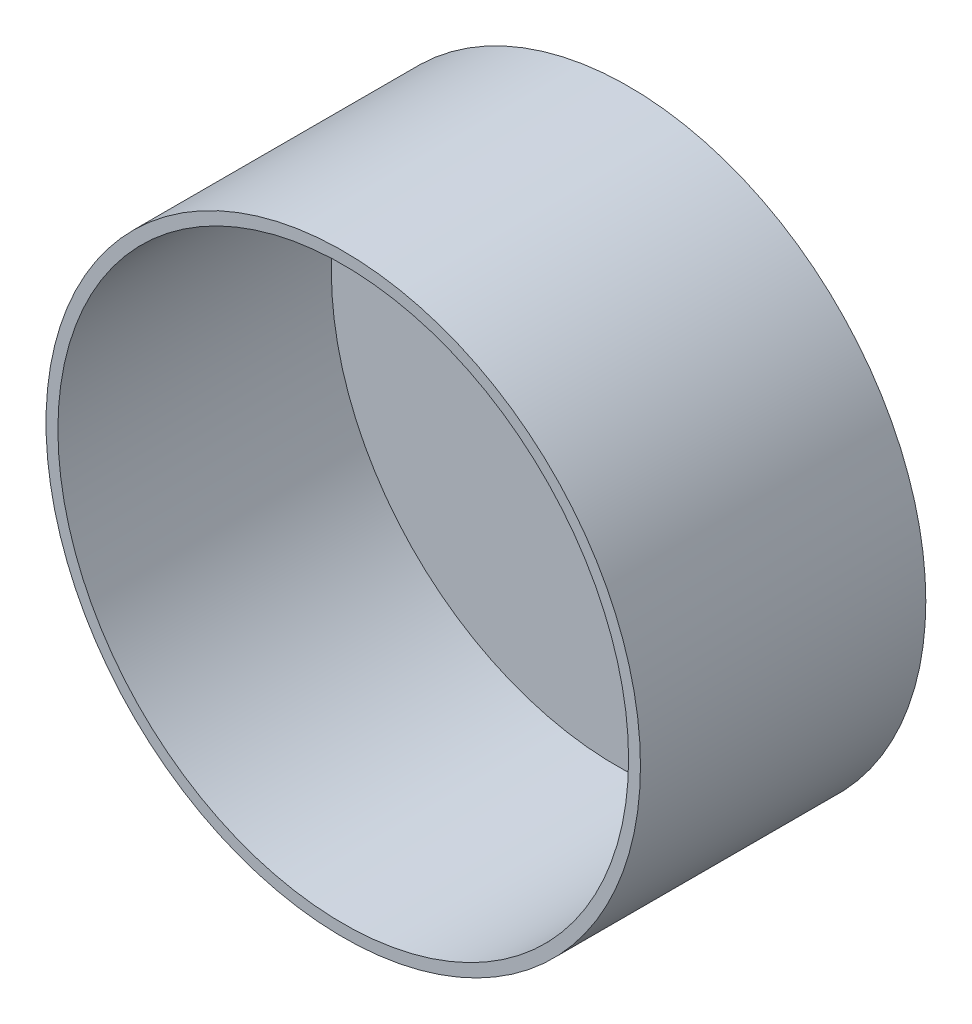
from build123d import *

# Parameters (mm, degrees)
OUTER_DIAMETER_SKETCH_R      = 125
OUTER_DIAMETER_EXTRUDE_DEPTH = 120
INNER_DIAMETER_SKETCH_R      = 120
INNER_DIAMETER_CUT_DEPTH     = 115


with BuildPart() as part:
    # Outer Diameter Sketch → Outer Diameter Extrude (new body)
    with BuildSketch(Plane.XY):
        Circle(OUTER_DIAMETER_SKETCH_R)
    extrude(amount=OUTER_DIAMETER_EXTRUDE_DEPTH)

    # Inner Diameter Sketch → Inner Diameter Cut (cut)
    with BuildSketch(Plane.XY.offset(120)):
        Circle(INNER_DIAMETER_SKETCH_R)
    extrude(amount=-INNER_DIAMETER_CUT_DEPTH, mode=Mode.SUBTRACT)


solid = part.part
